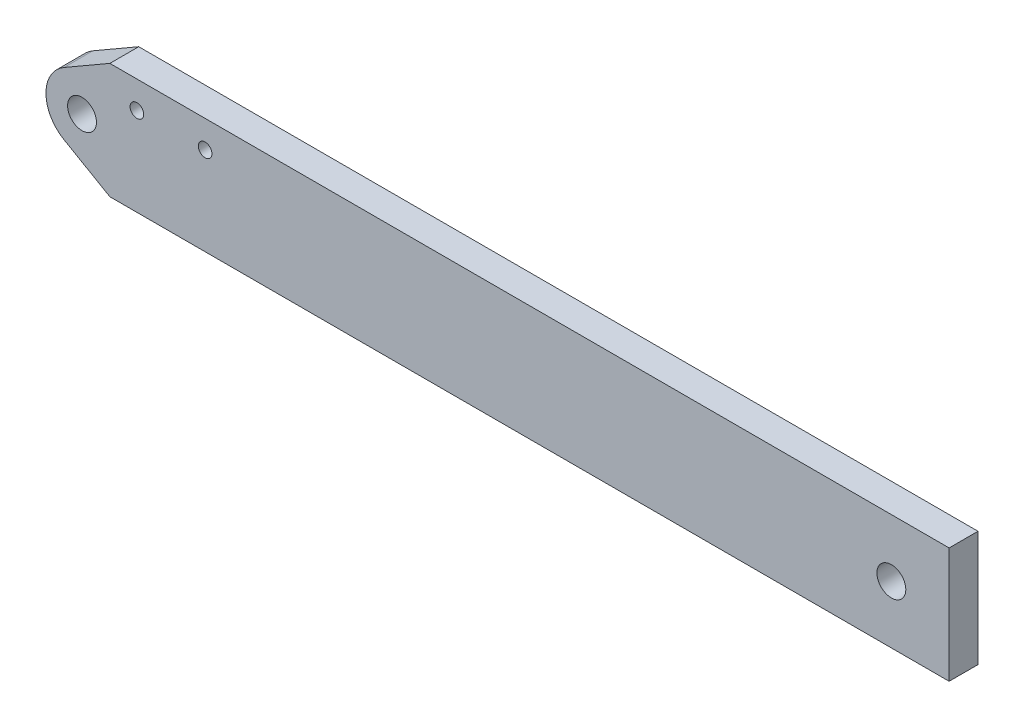
from build123d import *

# Parameters (mm, degrees)
SKETCH1_W           = 6.35
SKETCH1_H           = 25.4
BOSS_EXTRUDE1_DEPTH = 200
SKETCH2_R           = 3.175
CUT_EXTRUDE1_DEPTH  = 202.706426521
SKETCH3_R           = 3.175
CUT_EXTRUDE2_DEPTH  = 202.706426521
SKETCH6_R           = 1.5
CUT_EXTRUDE3_DEPTH  = 202.706426521


with BuildPart() as part:
    # Sketch1 → Boss-Extrude1 (new body)
    with BuildSketch(Plane(origin=(0, 0, 0), x_dir=(0, 0, -1), z_dir=(1, 0, 0))):
        with Locations((3.175, 12.7)):
            Rectangle(SKETCH1_W, SKETCH1_H)
    extrude(amount=BOSS_EXTRUDE1_DEPTH)

    # Sketch2 → Cut-Extrude1 (cut, through all)
    with BuildSketch(Plane.XY):
        with Locations((187.3, 12.7)):
            Circle(SKETCH2_R)
    extrude(amount=-CUT_EXTRUDE1_DEPTH, mode=Mode.SUBTRACT)

    # Sketch3 → Cut-Extrude2 (cut, through all)
    with BuildSketch(Plane.XY):
        with Locations((9.325, 12.7)):
            Circle(SKETCH3_R)
        with BuildLine():
            Line((15.442045256, 25.4), (-1, 25.4))
            Line((-1, 25.4), (-1, 0))
            Line((-1, 0), (15.442045256, 0))
            Line((15.442045256, 0), (5.354999675, 5.823758482))
            ThreePointArc((5.354999675, 5.823758482), (1.385, 12.7), (5.354999675, 19.576241518))
            Line((5.354999675, 19.576241518), (15.442045256, 25.4))
        make_face()
    extrude(amount=-CUT_EXTRUDE2_DEPTH, mode=Mode.SUBTRACT)

    # Sketch6 → Cut-Extrude3 (cut, through all)
    with BuildSketch(Plane.XY):
        with Locations((21.385, 19.4)):
            Circle(SKETCH6_R)
        with Locations((36.385, 19.4)):
            Circle(SKETCH6_R)
    extrude(amount=-CUT_EXTRUDE3_DEPTH, mode=Mode.SUBTRACT)


solid = part.part
